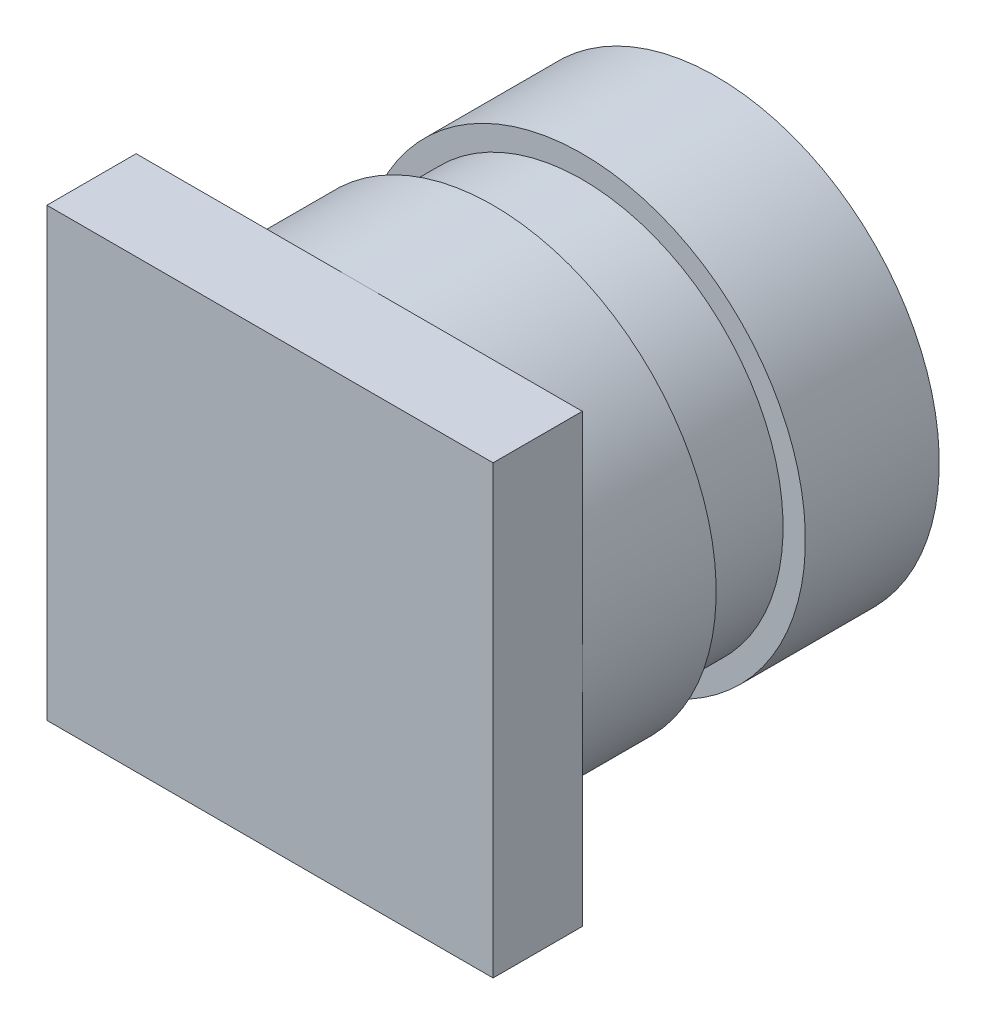
from build123d import *

# Parameters (mm, degrees)
ESQUISSE1_W             = 10
ESQUISSE1_H             = 10
BOSS_EXTRU_1_DEPTH      = 2
BOSS_EXTRU_2_DEPTH      = 3
ESQUISSE3_R             = 4.5
BOSS_EXTRU_3_DEPTH      = 2
BOSS_EXTRU_5_DEPTH      = 3
ENL_V_START             = -1
ENL_V_MAT_EXTRU_1_DEPTH = 1


with BuildPart() as part:
    # Esquisse1 → Boss.-Extru.1 (new body)
    with BuildSketch(Plane.XY):
        with Locations((5, 1.73860374)):
            Rectangle(ESQUISSE1_W, ESQUISSE1_H)
    extrude(amount=BOSS_EXTRU_1_DEPTH)

    # Esquisse2 → Boss.-Extru.2 (add)
    with BuildSketch(Plane(origin=(0, 0, 0), x_dir=(-1, 0, 0), z_dir=(0, 0, -1))):
        with BuildLine():
            ThreePointArc((-5, 6.73860374), (-6.913417162, 6.358001403), (-8.535533906, 5.274137646))
            Line((-8.535533906, 5.274137646), (-1.464466094, -1.796930166))
            ThreePointArc((-1.464466094, -1.796930166), (-0.380602337, -0.174813421), (0, 1.73860374))
            ThreePointArc((0, 1.73860374), (-1.464466094, 5.274137646), (-5, 6.73860374))
        make_face()
        with BuildLine():
            Line((-1.464466094, -1.796930166), (-8.535533906, 5.274137646))
            ThreePointArc((-8.535533906, 5.274137646), (-9.619397663, 3.652020902), (-10, 1.73860374))
            ThreePointArc((-10, 1.73860374), (-8.535533906, -1.796930166), (-5, -3.26139626))
            ThreePointArc((-5, -3.26139626), (-3.086582838, -2.880793922), (-1.464466094, -1.796930166))
        make_face()
    extrude(amount=BOSS_EXTRU_2_DEPTH)

    # Esquisse3 → Boss.-Extru.3 (add)
    with BuildSketch(Plane(origin=(0, 0, -3), x_dir=(-1, 0, 0), z_dir=(0, 0, -1))):
        with Locations((-5, 1.73860374)):
            Circle(ESQUISSE3_R)
    extrude(amount=BOSS_EXTRU_3_DEPTH)

    # Esquisse4 → Boss.-Extru.5 (add)
    with BuildSketch(Plane(origin=(0, 0, -5), x_dir=(-1, 0, 0), z_dir=(0, 0, -1))):
        with BuildLine():
            ThreePointArc((0, 1.73860374), (-3.086582838, 6.358001403), (-8.535533906, 5.274137646))
            Line((-8.535533906, 5.274137646), (-8.181980515, 4.920584256))
            ThreePointArc((-8.181980515, 4.920584256), (-3.277924554, 5.896061637), (-0.5, 1.73860374))
            ThreePointArc((-0.5, 1.73860374), (-0.842542104, 0.016528295), (-1.818019485, -1.443376775))
            Line((-1.818019485, -1.443376775), (-1.464466094, -1.796930166))
            ThreePointArc((-1.464466094, -1.796930166), (-0.380602337, -0.174813421), (0, 1.73860374))
        make_face()
        with BuildLine():
            Line((-8.181980515, 4.920584256), (-8.535533906, 5.274137646))
            ThreePointArc((-8.535533906, 5.274137646), (-8.535533906, -1.796930166), (-1.464466094, -1.796930166))
            Line((-1.464466094, -1.796930166), (-1.818019485, -1.443376775))
            ThreePointArc((-1.818019485, -1.443376775), (-8.181980515, -1.443376775), (-8.181980515, 4.920584256))
        make_face()
        with BuildLine():
            ThreePointArc((-0.5, 1.73860374), (-3.277924554, 5.896061637), (-8.181980515, 4.920584256))
            Line((-8.181980515, 4.920584256), (-1.818019485, -1.443376775))
            ThreePointArc((-1.818019485, -1.443376775), (-0.842542104, 0.016528295), (-0.5, 1.73860374))
        make_face()
        with BuildLine():
            Line((-1.818019485, -1.443376775), (-8.181980515, 4.920584256))
            ThreePointArc((-8.181980515, 4.920584256), (-8.181980515, -1.443376775), (-1.818019485, -1.443376775))
        make_face()
    extrude(amount=BOSS_EXTRU_5_DEPTH)

    # Esquisse5 → Enlèv. mat.-Extru.1 (cut)
    with BuildSketch(Plane(origin=(0, 0, -8), x_dir=(-1, 0, 0), z_dir=(0, 0, -1)).offset(ENL_V_START)):
        with BuildLine():
            ThreePointArc((-0.5, 1.73860374), (-3.277924554, 5.896061637), (-8.181980515, 4.920584256))
            Line((-8.181980515, 4.920584256), (-1.818019485, -1.443376775))
            ThreePointArc((-1.818019485, -1.443376775), (-0.842542104, 0.016528295), (-0.5, 1.73860374))
        make_face()
        with BuildLine():
            Line((-1.818019485, -1.443376775), (-8.181980515, 4.920584256))
            ThreePointArc((-8.181980515, 4.920584256), (-8.181980515, -1.443376775), (-1.818019485, -1.443376775))
        make_face()
    extrude(amount=ENL_V_MAT_EXTRU_1_DEPTH, mode=Mode.SUBTRACT)


solid = part.part
